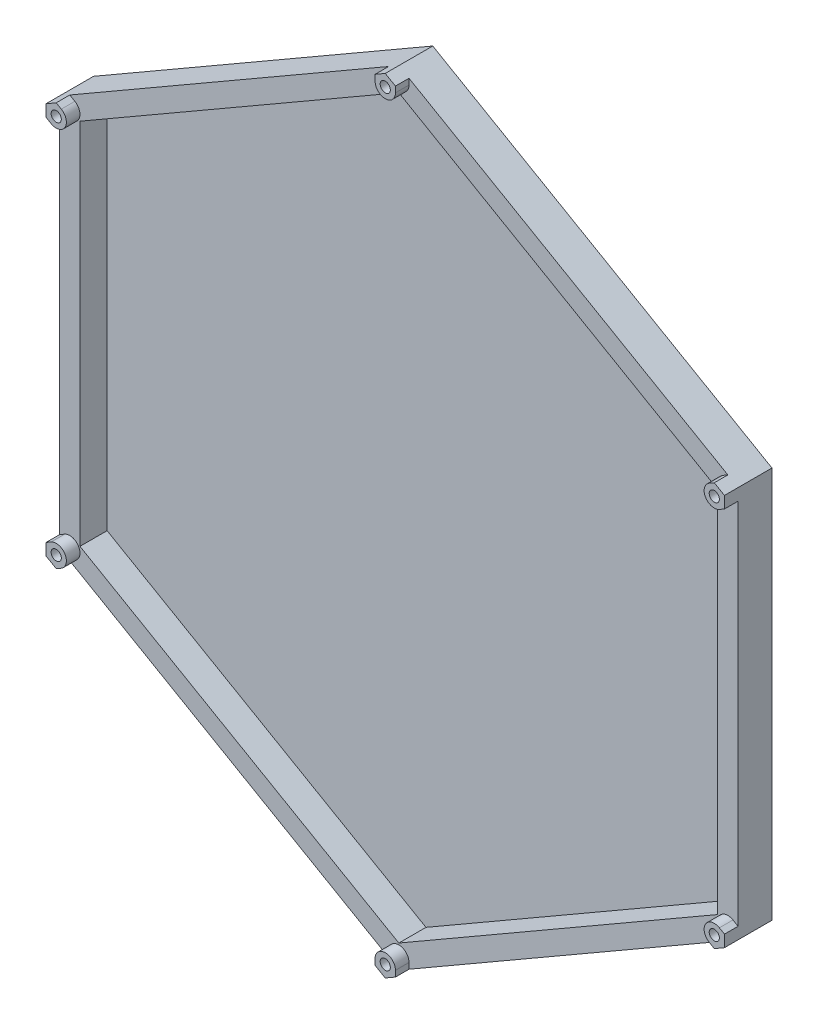
from build123d import *

# Parameters (mm, degrees)
BOSS_EXTRUDE1_DEPTH = 5
BOSS_EXTRUDE2_DEPTH = 1
SKETCH3_R           = 0.75
BOSS_EXTRUDE3_DEPTH = 2
CUT_EXTRUDE1_START  = -3
SKETCH4_R           = 0.75
CUT_EXTRUDE1_DEPTH  = 3


with BuildPart() as part:
    # Sketch1 → Boss-Extrude1 (new body)
    with BuildSketch(Plane.XY):
        Polygon((0, 57.735026919), (-50, 28.867513459), (-50, -28.867513459), (0, -57.735026919), (50, -28.867513459), (50, 28.867513459), align=None)
        Polygon((0, 54.270925304), (-47, 27.135462652), (-47, -27.135462652), (0, -54.270925304), (47, -27.135462652), (47, 27.135462652), align=None, mode=Mode.SUBTRACT)
    extrude(amount=BOSS_EXTRUDE1_DEPTH)

    # Sketch2 → Boss-Extrude2 (add)
    with BuildSketch(Plane(origin=(0, 0, 0), x_dir=(-1, 0, 0), z_dir=(0, 0, -1))):
        Polygon((-47, -27.135462652), (-47, 27.135462652), (0, 54.270925304), (47, 27.135462652), (47, -27.135462652), (0, -54.270925304), align=None)
    extrude(amount=-BOSS_EXTRUDE2_DEPTH)

    # Sketch3 → Boss-Extrude3 (add)
    # profile 1 of 6: a face of its own
    with BuildSketch(Plane.XY.offset(5)):
        with BuildLine():
            Line((1.5, 56.002976111), (1.5, 56.869001515))
            Line((1.5, 56.869001515), (0, 57.735026919))
            Line((0, 57.735026919), (-1.5, 56.869001515))
            Line((-1.5, 56.869001515), (-1.5, 56.002976111))
            ThreePointArc((-1.5, 56.002976111), (0, 54.502976111), (1.5, 56.002976111))
        make_face()
        with Locations((0, 56.002976111)):
            Circle(SKETCH3_R, mode=Mode.SUBTRACT)
    # profile 2 of 6: a face of its own
    with BuildSketch(Plane.XY.offset(5)):
        with BuildLine():
            Line((50, 27.135462652), (50, 28.867513459))
            Line((50, 28.867513459), (48.5, 29.733538863))
            Line((48.5, 29.733538863), (47.75, 29.300526161))
            ThreePointArc((47.75, 29.300526161), (47.200961894, 27.251488056), (49.25, 26.70244995))
            Line((49.25, 26.70244995), (50, 27.135462652))
        make_face()
        with Locations((48.5, 28.001488056)):
            Circle(SKETCH3_R, mode=Mode.SUBTRACT)
    # profile 3 of 6: a face of its own
    with BuildSketch(Plane.XY.offset(5)):
        with BuildLine():
            Line((50, -28.867513459), (50, -27.135462652))
            Line((50, -27.135462652), (49.25, -26.70244995))
            ThreePointArc((49.25, -26.70244995), (47.200961894, -27.251488056), (47.75, -29.300526161))
            Line((47.75, -29.300526161), (48.5, -29.733538863))
            Line((48.5, -29.733538863), (50, -28.867513459))
        make_face()
        with Locations((48.5, -28.001488056)):
            Circle(SKETCH3_R, mode=Mode.SUBTRACT)
    # profile 4 of 6: a face of its own
    with BuildSketch(Plane.XY.offset(5)):
        with BuildLine():
            Line((0, -57.735026919), (1.5, -56.869001515))
            Line((1.5, -56.869001515), (1.5, -56.002976111))
            ThreePointArc((1.5, -56.002976111), (0, -54.502976111), (-1.5, -56.002976111))
            Line((-1.5, -56.002976111), (-1.5, -56.869001515))
            Line((-1.5, -56.869001515), (0, -57.735026919))
        make_face()
        with Locations((0, -56.002976111)):
            Circle(SKETCH3_R, mode=Mode.SUBTRACT)
    # profile 5 of 6: a face of its own
    with BuildSketch(Plane.XY.offset(5)):
        with BuildLine():
            Line((-50, -28.867513459), (-48.5, -29.733538863))
            Line((-48.5, -29.733538863), (-47.75, -29.300526161))
            ThreePointArc((-47.75, -29.300526161), (-47.200961894, -27.251488056), (-49.25, -26.70244995))
            Line((-49.25, -26.70244995), (-50, -27.135462652))
            Line((-50, -27.135462652), (-50, -28.867513459))
        make_face()
        with Locations((-48.5, -28.001488056)):
            Circle(SKETCH3_R, mode=Mode.SUBTRACT)
    # profile 6 of 6: a face of its own
    with BuildSketch(Plane.XY.offset(5)):
        with BuildLine():
            Line((-47.75, 29.300526161), (-48.5, 29.733538863))
            Line((-48.5, 29.733538863), (-50, 28.867513459))
            Line((-50, 28.867513459), (-50, 27.135462652))
            Line((-50, 27.135462652), (-49.25, 26.70244995))
            ThreePointArc((-49.25, 26.70244995), (-47.200961894, 27.251488056), (-47.75, 29.300526161))
        make_face()
        with Locations((-48.5, 28.001488056)):
            Circle(SKETCH3_R, mode=Mode.SUBTRACT)
    extrude(amount=BOSS_EXTRUDE3_DEPTH)

    # Sketch4 → Cut-Extrude1 (cut)
    with BuildSketch(Plane.XY.offset(5).offset(CUT_EXTRUDE1_START)):
        with Locations((0, 56.002976111)):
            Circle(SKETCH4_R)
        with Locations((-48.5, 28.001488056)):
            Circle(SKETCH4_R)
        with Locations((-48.5, -28.001488056)):
            Circle(SKETCH4_R)
        with Locations((0, -56.002976111)):
            Circle(SKETCH4_R)
        with Locations((48.5, -28.001488056)):
            Circle(SKETCH4_R)
        with Locations((48.5, 28.001488056)):
            Circle(SKETCH4_R)
    extrude(amount=CUT_EXTRUDE1_DEPTH, mode=Mode.SUBTRACT)


solid = part.part
